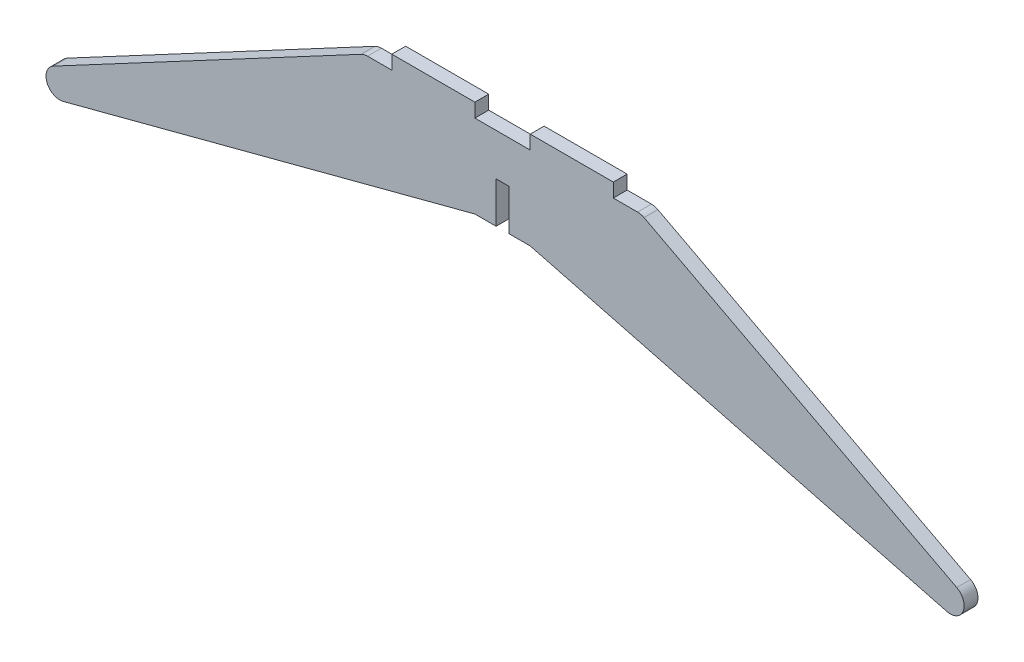
from build123d import *

# Parameters (mm, degrees)
BOSS_EXTRUDE1_DEPTH = 3.175


with BuildPart() as part:
    # Sketch1 → Boss-Extrude1 (new body)
    with BuildSketch(Plane.XY):
        with BuildLine():
            Line((25.4, 0), (30.968022768, 0))
            ThreePointArc((30.968022768, 0), (31.727309935, -0.092126666), (32.442533736, -0.363160318))
            Line((32.442533736, -0.363160318), (104.164919452, -37.973926384))
            ThreePointArc((104.164919452, -37.973926384), (105.652252875, -41.929489282), (101.892440564, -43.858854448))
            Line((101.892440564, -43.858854448), (6.35, -19.05))
            Line((6.35, -19.05), (1.4859, -19.05))
            Line((1.4859, -19.05), (1.4859, -9.6266))
            Line((1.4859, -9.6266), (-1.4859, -9.6266))
            Line((-1.4859, -9.6266), (-1.4859, -19.05))
            Line((-1.4859, -19.05), (-6.35, -19.05))
            Line((-6.35, -19.05), (-100.721752752, -43.884671777))
            ThreePointArc((-100.721752752, -43.884671777), (-104.48570891, -41.973107935), (-103.023886624, -38.012739532))
            Line((-103.023886624, -38.012739532), (-32.450367647, -0.373529412))
            ThreePointArc((-32.450367647, -0.373529412), (-31.726300609, -0.094797562), (-30.95625, 0))
            Line((-30.95625, 0), (-25.4, 0))
            Line((-25.4, 0), (-25.399999646, 3.174999957))
            Line((-25.399999646, 3.174999957), (-6.349999646, 3.174999957))
            Line((-6.349999646, 3.174999957), (-6.35, 0))
            Line((-6.35, 0), (6.35, 0))
            Line((6.35, 0), (6.350000354, 3.174999957))
            Line((6.350000354, 3.174999957), (25.400000354, 3.174999957))
            Line((25.400000354, 3.174999957), (25.4, 0))
        make_face()
    extrude(amount=BOSS_EXTRUDE1_DEPTH)


solid = part.part
